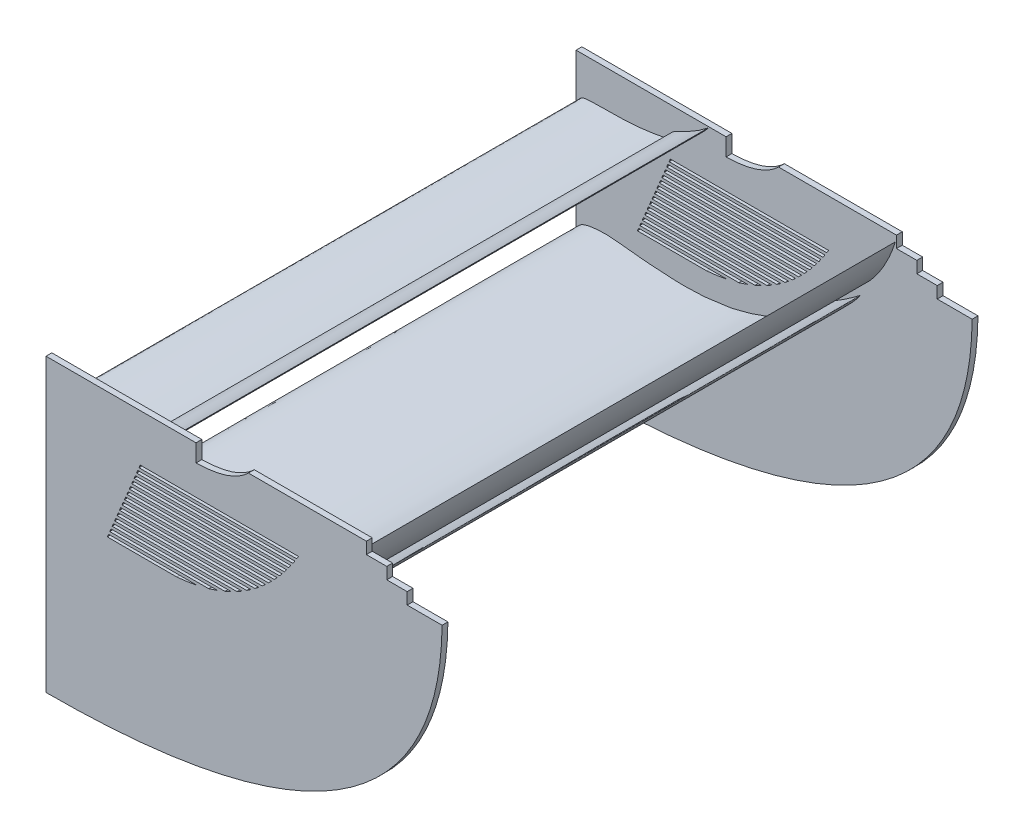
from build123d import *

# Parameters (mm, degrees)
BOSS_EXTRUDE1_DEPTH   = 900
BOSS_EXTRUDE1_2_DEPTH = 900
BOSS_EXTRUDE1_3_DEPTH = 900
BOSS_EXTRUDE2_DEPTH   = 10
BOSS_EXTRUDE3_DEPTH   = 900
CUT_EXTRUDE1_DEPTH    = 900
CUT_EXTRUDE2_DEPTH    = 900


with BuildPart() as part:
    # Sketch2 → Boss-Extrude1 (new body)
    with BuildSketch(Plane.XY):
        with BuildLine():
            add(Edge.make_bspline(
                [(0, 0), (-0.65975565, -5.699703464), (8.017548516, -15.480562025), (19.551157506, -21.724015646), (30.016745353, -25.302215165), (39.859962541, -28.8642232), (50.040399275, -30.662933418), (60.070603806, -32.257702331), (70.013877162, -34.217674322), (80.100972933, -34.55999195), (90.093066457, -35.36519438), (100.111969814, -35.952943269), (110.128217778, -35.507216678), (120.153157744, -35.210003546), (130.150331683, -34.229800116), (140.189993261, -33.410162922), (150.178235204, -31.913406007), (160.170449627, -30.371338734), (170.240789754, -29.163640841), (180.208316099, -27.151030087), (190.263801281, -25.306120223), (200.239152099, -22.872450662), (210.244577583, -20.429111012), (220.232934245, -17.895088966), (230.381125348, -15.705438437), (240.351948949, -12.391144832), (253.551193017, -7.369638816), (266.947574476, -2.806549313), (280.436865809, 1.636643436), (290.361357742, 5.819516769), (300.440735094, 10.032227759), (310.304777653, 14.884053202), (323.821431636, 20.884190166), (337.30228202, 27.249833417), (350.274680503, 34.850235797), (364.037447664, 41.200679435), (378.073354269, 50.431878374), (389.268655411, 56.991671546), (404.933124868, 70.670428585), (388.893146181, 60.897261379), (380.961681237, 56.833339948), (370.316551331, 52.173205743), (360.413556578, 47.749137904), (350.469658047, 43.075442492), (340.496714174, 38.833200032), (330.405194537, 35.260956145), (320.349773519, 31.849438488), (310.358327921, 28.32591748), (300.486931551, 24.662169398), (290.321799777, 22.300639283), (280.290360105, 19.76188557), (270.426731207, 16.765017679), (260.335958512, 15.061341224), (250.276874186, 13.958758108), (240.266180313, 12.578254982), (230.278688892, 11.06786106), (220.28670052, 9.696364143), (210.243264635, 9.240413966), (200.228739037, 9.034505305), (190.217040672, 8.279165066), (180.212460889, 9.162360851), (170.184221628, 8.728504773), (160.186505008, 9.582197967), (150.167787888, 9.989196896), (140.163470123, 10.700746944), (130.145958281, 11.214450998), (120.121382338, 11.840881885), (110.132801048, 12.969737489), (100.114836916, 13.850136605), (90.093770057, 14.715857774), (80.079633724, 15.842660607), (56.917746978, 18.847498868), (32.382831952, 18.963380484), (8.41761673, 12.262874152), (0.546057517, 4.717452477), (0, 0)],
                knots=[0, 0, 0, 0, 0.022023736, 0.035622153, 0.048196888, 0.060584536, 0.072602109, 0.084545422, 0.096478612, 0.108283816, 0.120089627, 0.131879307, 0.143660654, 0.15544949, 0.167268546, 0.17910001, 0.190991158, 0.20289685, 0.214787999, 0.226765538, 0.23876847, 0.250863752, 0.262991876, 0.27512, 0.287234564, 0.299600692, 0.31214973, 0.337081787, 0.34954249, 0.362249466, 0.375072168, 0.388091419, 0.401030286, 0.427260863, 0.440708926, 0.453891579, 0.481343844, 0.495528159, 0.510184265, 0.522427916, 0.535732546, 0.548643086, 0.561553626, 0.574510663, 0.587286643, 0.599816472, 0.612271303, 0.624763182, 0.637218013, 0.649381244, 0.661544475, 0.673750263, 0.685718325, 0.697586388, 0.709471547, 0.721375261, 0.733243324, 0.745039761, 0.756824219, 0.768610895, 0.780397571, 0.792175284, 0.803971722, 0.815766061, 0.82756692, 0.839363385, 0.851169099, 0.863005976, 0.874833225, 0.886659586, 0.898509641, 0.910371212, 0.969295412, 0.981771696, 1, 1, 1, 1], degree=3))
        make_face()
    extrude(amount=BOSS_EXTRUDE1_DEPTH)



with BuildPart() as body_2:
    # Sketch2 → Boss-Extrude1 2 (new body)
    with BuildSketch(Plane.XY):
        with BuildLine():
            add(Edge.make_bspline(
                [(488.73992863, 146.276625829), (488.734390863, 146.282664356), (488.424255517, 146.015046997), (488.06224571, 145.78510435), (487.262468982, 145.126312202), (486.219708703, 144.371292999), (484.873478649, 143.336701677), (483.250678892, 142.116067573), (481.344943871, 140.702556836), (479.183854282, 139.108333078), (476.761259361, 137.364331889), (474.123745832, 135.449437464), (471.236790602, 133.439330858), (468.165688429, 131.291310186), (464.896239769, 129.067635846), (461.457519682, 126.769533617), (457.874048726, 124.410588123), (454.151349507, 122.026984888), (450.329646269, 119.608278587), (446.41836705, 117.19210493), (442.442349173, 114.792641259), (438.43193703, 112.415341988), (434.42114363, 110.058907294), (430.419325782, 107.74839744), (426.469079038, 105.475179612), (422.572434597, 103.270040027), (418.782946314, 101.105445668), (415.103822048, 99.01892845), (411.581105321, 96.980001912), (408.223119368, 95.024650916), (405.070149132, 93.117181313), (402.117764879, 91.312769814), (399.415735867, 89.554324386), (396.965291652, 87.893504979), (394.792388291, 86.318571947), (392.915837215, 84.829964237), (391.349809227, 83.430905822), (390.083467317, 82.150893966), (389.152598068, 80.964624913), (388.566460536, 79.872034746), (388.31048608, 78.86894122), (388.452520239, 77.947544055), (389.013376817, 77.204475769), (389.915554573, 76.684991476), (391.128157446, 76.384212118), (392.650081725, 76.254634507), (394.48507873, 76.313765499), (396.623198675, 76.579439281), (399.045948072, 77.035742523), (401.735792151, 77.720460618), (404.675674285, 78.596752435), (407.839178956, 79.704940552), (411.200777121, 81.026852514), (414.720896472, 82.590974299), (418.395557374, 84.341793332), (422.179917585, 86.309143039), (426.045683707, 88.480043342), (429.970357242, 90.828820323), (433.914957703, 93.364526939), (437.871228384, 96.040204149), (441.793376071, 98.866131635), (445.668479549, 101.797178284), (449.465692449, 104.827226536), (453.167907327, 107.924049831), (456.76145535, 111.053999458), (460.202936902, 114.219487851), (463.519091154, 117.342970547), (466.650128692, 120.455005022), (469.613566921, 123.489837804), (472.370170636, 126.450937081), (474.953957291, 129.265647603), (477.297780382, 131.960513478), (479.456204478, 134.463515761), (481.381106749, 136.784579704), (483.077897662, 138.897364919), (484.557730654, 140.769579134), (485.809879979, 142.38248786), (486.847928071, 143.738913606), (487.625844434, 144.768628828), (488.251100258, 145.595659419), (488.480713959, 145.957078055), (488.74539046, 146.270670107), (488.73992863, 146.276625829)],
                knots=[0, 0, 0, 0, 0.000781199, 0.003073574, 0.006930933, 0.012248071, 0.019030102, 0.027225991, 0.036784991, 0.047610037, 0.059602429, 0.072763906, 0.086896902, 0.102003859, 0.117938515, 0.134556032, 0.151857595, 0.169650659, 0.187837924, 0.206373783, 0.225065344, 0.243814112, 0.262569213, 0.281136751, 0.299513586, 0.317505655, 0.335105223, 0.352118009, 0.368487898, 0.384166869, 0.39895523, 0.412906354, 0.425871787, 0.437810597, 0.448585292, 0.458212857, 0.466668993, 0.473884465, 0.479894259, 0.484778924, 0.488742849, 0.492166792, 0.495627983, 0.499576303, 0.504486665, 0.51057614, 0.517942731, 0.526573967, 0.536524046, 0.547640111, 0.560015283, 0.573490911, 0.58803144, 0.603543533, 0.619911609, 0.637089411, 0.654944026, 0.673346428, 0.692212491, 0.711460838, 0.730910148, 0.750475101, 0.77002178, 0.789460649, 0.808651173, 0.827457923, 0.845819698, 0.863558965, 0.880665567, 0.896944906, 0.912322084, 0.926717772, 0.939992516, 0.952161421, 0.963060032, 0.972661788, 0.980906352, 0.987732879, 0.993080076, 0.996902186, 0.999229514, 1, 1, 1, 1], degree=3))
        make_face()
    extrude(amount=BOSS_EXTRUDE1_2_DEPTH)


with BuildPart() as body_3:
    # Sketch2 → Boss-Extrude1 3 (new body)
    with BuildSketch(Plane.XY):
        with BuildLine():
            add(Edge.make_bspline(
                [(548.142677429, 255.362022493), (548.135374227, 255.365952606), (547.927936153, 255.006923964), (547.658371583, 254.666651265), (547.113002911, 253.770748213), (546.367364831, 252.702005657), (545.424638558, 251.265023805), (544.27941979, 249.558165284), (542.927897021, 247.572779047), (541.392389605, 245.329670238), (539.656724271, 242.856366084), (537.77246287, 240.148181213), (535.681420522, 237.265978202), (533.460225952, 234.1906606), (531.074588655, 230.97702341), (528.551895931, 227.635912658), (525.911068883, 224.188473742), (523.145346923, 220.671136821), (520.29665909, 217.087300279), (517.361495783, 213.476080086), (514.358883712, 209.859293663), (511.316016626, 206.252251869), (508.265842752, 202.665029322), (505.208968651, 199.124696426), (502.1889872, 195.637173296), (499.197596623, 192.232566763), (496.295154414, 188.902374923), (493.472239146, 185.683544867), (490.783011296, 182.562252326), (488.223454385, 179.575667492), (485.843956575, 176.703071592), (483.621924068, 173.995738505), (481.623931594, 171.41564926), (479.833965661, 169.012598811), (478.280745879, 166.784000715), (476.982109533, 164.736533764), (475.9505309, 162.877995089), (475.165835333, 161.232977644), (474.670653437, 159.789198906), (474.473857946, 158.549678558), (474.562913108, 157.505571006), (475.005273255, 156.671993733), (475.788683212, 156.148250847), (476.823995566, 155.951818146), (478.083297743, 156.067751239), (479.581340455, 156.450270824), (481.315884792, 157.117361276), (483.27148496, 158.082761094), (485.435756441, 159.325104089), (487.779363945, 160.874677932), (490.298259918, 162.690587977), (492.953775055, 164.80259248), (495.727550679, 167.184824621), (498.572278285, 169.851349424), (501.502624239, 172.747773867), (504.46579375, 175.887697633), (507.439057803, 179.249297912), (510.409450838, 182.800544998), (513.336696107, 186.537123271), (516.228525151, 190.411393589), (519.037740226, 194.417946242), (521.767005491, 198.509337516), (524.388867963, 202.669455575), (526.897696092, 206.861800297), (529.291618766, 211.049656155), (531.528344155, 215.220888935), (533.659235885, 219.310264722), (535.616969063, 223.327101968), (537.440168258, 227.214370322), (539.090171449, 230.962330487), (540.623673351, 234.512844247), (541.967651222, 237.868945421), (543.198230675, 240.979940777), (544.266104832, 243.839306635), (545.18521028, 246.423662369), (545.97695415, 248.705848341), (546.637316417, 250.664385968), (547.178342468, 252.306492823), (547.579395063, 253.549717004), (547.901947032, 254.548383811), (548.001197383, 254.970292394), (548.149880485, 255.358146272), (548.142677429, 255.362022493)],
                knots=[0, 0, 0, 0, 0.000781199, 0.003073574, 0.006930933, 0.012248071, 0.019030102, 0.027225991, 0.036784991, 0.047610037, 0.059602429, 0.072763906, 0.086896902, 0.102003859, 0.117938515, 0.134556032, 0.151857595, 0.169650659, 0.187837924, 0.206373783, 0.225065344, 0.243814112, 0.262569213, 0.281136751, 0.299513586, 0.317505655, 0.335105223, 0.352118009, 0.368487898, 0.384166869, 0.39895523, 0.412906354, 0.425871787, 0.437810597, 0.448585292, 0.458212857, 0.466668993, 0.473884465, 0.479894259, 0.484778924, 0.488742849, 0.492166792, 0.495627983, 0.499576303, 0.504486665, 0.51057614, 0.517942731, 0.526573967, 0.536524046, 0.547640111, 0.560015283, 0.573490911, 0.58803144, 0.603543533, 0.619911609, 0.637089411, 0.654944026, 0.673346428, 0.692212491, 0.711460838, 0.730910148, 0.750475101, 0.77002178, 0.789460649, 0.808651173, 0.827457923, 0.845819698, 0.863558965, 0.880665567, 0.896944906, 0.912322084, 0.926717772, 0.939992516, 0.952161421, 0.963060032, 0.972661788, 0.980906352, 0.987732879, 0.993080076, 0.996902186, 0.999229514, 1, 1, 1, 1], degree=3))
        make_face()
    extrude(amount=BOSS_EXTRUDE1_3_DEPTH)


with BuildPart() as part_1:
    add(part.part)

    add(body_2.part)  # Boss-Extrude2 merges body 2

    add(body_3.part)  # Boss-Extrude2 merges body 3
    # Sketch5 → Boss-Extrude2 (add)
    with BuildSketch(Plane.XY):
        with BuildLine():
            Line((0, 266.2835253), (550.000000941, 266.2835253))
            Line((550.000000941, 266.2835253), (550.000000941, 246.2835253))
            Line((550.000000941, 246.2835253), (585.000000941, 246.2835253))
            Line((585.000000941, 246.2835253), (585.000000941, 226.2835253))
            Line((585.000000941, 226.2835253), (620.000000941, 226.2835253))
            Line((620.000000941, 226.2835253), (620.000000941, 206.2835253))
            Line((620.000000941, 206.2835253), (680.000000941, 206.2835253))
            add(Edge.make_bspline(
                [(680.000000941, 206.2835253), (675.000000941, -233.7164747), (0, -233.7164747)],
                knots=[0, 0, 0, 1, 1, 1], degree=2))
            Line((0, -233.7164747), (0, 0))
            Line((0, 0), (0, 266.2835253))
        make_face()
    boss_extrude2 = extrude(amount=-BOSS_EXTRUDE2_DEPTH)

    # Sketch6 → Boss-Extrude3 (add)
    with BuildSketch(Plane.XY):
        with BuildLine():
            Line((164.613779142, 214.976136412), (164.723820378, 214.664469851))
            add(Edge.make_bspline(
                [(164.723820378, 214.664469851), (164.648520792, 214.62785328), (164.34784185, 214.481639572), (163.6724355, 214.155247545), (162.549996952, 213.617503095), (160.985188719, 212.878254816), (158.984976969, 211.950245078), (156.558091459, 210.85008651), (153.715646415, 209.596574891), (150.470623362, 208.21147628), (146.838789716, 206.717746076), (142.837921693, 205.140231242), (138.488175426, 203.504962048), (133.812181859, 201.837638924), (128.834692226, 200.164989269), (123.582914289, 198.512714614), (118.086213642, 196.905948015), (112.376209789, 195.368272822), (106.486191905, 193.922834665), (100.451747873, 192.589384758), (94.309682922, 191.38731623), (88.098789404, 190.332048871), (81.858862431, 189.437445075), (75.630944666, 188.713169975), (69.456595048, 188.167141909), (63.377832973, 187.802732102), (57.436667454, 187.619920942), (51.674457693, 187.615799885), (46.131746943, 187.783455241), (40.847534236, 188.112237796), (35.858963346, 188.588868306), (31.20097477, 189.198026011), (26.905404603, 189.920290668), (23.001348407, 190.736844339), (19.514136341, 191.626300897), (16.465607968, 192.567963312), (13.873059459, 193.541178882), (11.74976335, 194.527328758), (10.100256038, 195.510564925), (8.925718365, 196.483778626), (8.206176783, 197.466132507), (8.02697547, 198.508882414), (8.470227148, 199.467441428), (9.409476098, 200.23160778), (10.773566742, 200.880043737), (12.581737712, 201.435839127), (14.827891197, 201.90662304), (17.501946446, 202.294971106), (20.58639208, 202.606885827), (24.061416159, 202.847331482), (27.90441349, 203.025263473), (32.091168331, 203.149306121), (36.595944484, 203.230963582), (41.391766004, 203.282006476), (46.450521964, 203.315413628), (51.743070657, 203.344475349), (57.239340133, 203.383502231), (62.908274903, 203.445583094), (68.717937055, 203.543500979), (74.635487392, 203.689136944), (80.627254443, 203.892101324), (86.658821204, 204.160206649), (92.695207803, 204.498909479), (98.701000079, 204.910411263), (104.640477999, 205.395096222), (110.477863333, 205.94945889), (116.177758049, 206.567602145), (121.705063984, 207.24121294), (127.025524467, 207.95920193), (132.10555678, 208.709379121), (136.913134386, 209.476904936), (141.417305129, 210.247217657), (145.589030953, 211.004246644), (149.400935644, 211.732409722), (152.827876226, 212.416494827), (155.846829262, 213.041879937), (158.437432591, 213.595225115), (160.581893041, 214.064998422), (162.265605107, 214.441007828), (163.476700085, 214.71550428), (164.206793843, 214.882591132), (164.532232533, 214.957392982), (164.613779142, 214.976136412)],
                knots=[0, 0, 0, 0, 0.000779512, 0.003112672, 0.006983595, 0.012366453, 0.01922443, 0.027511488, 0.037172952, 0.048145315, 0.060357993, 0.073731396, 0.088181725, 0.103618331, 0.119946063, 0.137064586, 0.154870456, 0.17325674, 0.192112831, 0.211327336, 0.230785914, 0.250372996, 0.269971687, 0.289465461, 0.308737124, 0.32767029, 0.346151173, 0.364066139, 0.381306847, 0.39776766, 0.413347451, 0.427951846, 0.441492525, 0.453889871, 0.465073667, 0.474985038, 0.483580064, 0.490834634, 0.496756017, 0.501407245, 0.504968517, 0.50787306, 0.510776977, 0.514326794, 0.518938798, 0.524777979, 0.531895445, 0.540287366, 0.549922226, 0.560751286, 0.572712462, 0.585735823, 0.599744882, 0.61465722, 0.63038614, 0.646841751, 0.663930407, 0.681556403, 0.699621216, 0.718024312, 0.736663476, 0.755434295, 0.774231121, 0.792947914, 0.811476445, 0.829708517, 0.847535554, 0.86485073, 0.881545736, 0.89751548, 0.912656405, 0.926869016, 0.94005631, 0.952127904, 0.962998201, 0.972589475, 0.980830171, 0.987660039, 0.993027268, 0.996891237, 0.999221024, 1, 1, 1, 1], degree=3))
        make_face()
        with BuildLine():
            Line((227.014165374, 264.226922408), (227.124498683, 264.117683735))
            add(Edge.make_bspline(
                [(227.124498683, 264.117683735), (227.100159849, 264.086786218), (227.002972401, 263.963409277), (226.784244674, 263.687135237), (226.419789721, 263.229980722), (225.90956242, 262.59706416), (225.25389914, 261.795199069), (224.453089487, 260.833196326), (223.507984217, 259.721278001), (222.419615428, 258.471304258), (221.18994955, 257.09620847), (219.821415035, 255.610135011), (218.317204263, 254.028215794), (216.681623457, 252.365949967), (214.919665011, 250.639704962), (213.037569937, 248.865917434), (211.042607934, 247.061225478), (208.943318901, 245.242073454), (206.749038269, 243.425062503), (204.470768289, 241.625829285), (202.120099201, 239.8601083), (199.710274859, 238.142361018), (197.255281925, 236.486595763), (194.770493839, 234.905301737), (192.271859948, 233.410335323), (189.776455231, 232.011724723), (187.302044509, 230.718062416), (184.866709335, 229.536586443), (182.489006296, 228.472674472), (180.187603898, 227.52980869), (177.980924736, 226.709979502), (175.886877861, 226.013863102), (173.922899143, 225.439766898), (172.105142481, 224.985691856), (170.448695615, 224.647782235), (168.967029431, 224.421758982), (167.671684859, 224.302431588), (166.572085289, 224.284645643), (165.673393307, 224.362629601), (164.977563579, 224.533619745), (164.472228287, 224.801628451), (164.182975782, 225.205799004), (164.174124327, 225.701813604), (164.414772581, 226.217190457), (164.858731971, 226.770618702), (165.509408986, 227.375799229), (166.362663608, 228.034709064), (167.413706516, 228.746373252), (168.653905221, 229.509744345), (170.073867156, 230.322864947), (171.662201674, 231.184893168), (173.406905, 232.094517404), (175.294740921, 233.051332311), (177.311894526, 234.054791381), (179.443823684, 235.104626545), (181.675486694, 236.200490389), (183.991239673, 237.342276403), (186.375273051, 238.529160164), (188.811466791, 239.760007307), (191.28350447, 241.033117593), (193.775182692, 242.345660362), (196.270350938, 243.693892226), (198.753103068, 245.072958488), (201.208015771, 246.476539327), (203.619908469, 247.897483995), (205.974372342, 249.326985329), (208.257648968, 250.755302848), (210.456601334, 252.171736048), (212.559016607, 253.564582929), (214.553192236, 254.921814136), (216.428626064, 256.230598714), (218.17521328, 257.47844315), (219.783967257, 258.652607865), (221.246503967, 259.740900035), (222.555307784, 260.731740538), (223.703638392, 261.614233662), (224.685618133, 262.378570601), (225.496085319, 263.016232908), (226.130951632, 263.519921264), (226.586785668, 263.883929527), (226.861249996, 264.104048143), (226.983526109, 264.202302404), (227.014165374, 264.226922408)],
                knots=[0, 0, 0, 0, 0.000779512, 0.003112672, 0.006983595, 0.012366453, 0.01922443, 0.027511488, 0.037172952, 0.048145315, 0.060357993, 0.073731396, 0.088181725, 0.103618331, 0.119946063, 0.137064586, 0.154870456, 0.17325674, 0.192112831, 0.211327336, 0.230785914, 0.250372996, 0.269971687, 0.289465461, 0.308737124, 0.32767029, 0.346151173, 0.364066139, 0.381306847, 0.39776766, 0.413347451, 0.427951846, 0.441492525, 0.453889871, 0.465073667, 0.474985038, 0.483580064, 0.490834634, 0.496756017, 0.501407245, 0.504968517, 0.50787306, 0.510776977, 0.514326794, 0.518938798, 0.524777979, 0.531895445, 0.540287366, 0.549922226, 0.560751286, 0.572712462, 0.585735823, 0.599744882, 0.61465722, 0.63038614, 0.646841751, 0.663930407, 0.681556403, 0.699621216, 0.718024312, 0.736663476, 0.755434295, 0.774231121, 0.792947914, 0.811476445, 0.829708517, 0.847535554, 0.86485073, 0.881545736, 0.89751548, 0.912656405, 0.926869016, 0.94005631, 0.952127904, 0.962998201, 0.972589475, 0.980830171, 0.987660039, 0.993027268, 0.996891237, 0.999221024, 1, 1, 1, 1], degree=3))
        make_face()
    extrude(amount=BOSS_EXTRUDE3_DEPTH)

    # Sketch7 → Cut-Extrude1 (cut)
    with BuildSketch(Plane.XY):
        with BuildLine():
            Line((257.530092853, 266.2835253), (257.530092853, 236.2835253))
            add(Edge.make_bspline(
                [(347.530092853, 266.2835253), (317.571378056, 237.21102108), (257.530092853, 236.2835253)],
                knots=[0, 0, 0, 1, 1, 1], degree=2))
            Line((347.530092853, 266.2835253), (257.530092853, 266.2835253))
        make_face()
    cut_extrude1 = extrude(amount=-CUT_EXTRUDE1_DEPTH, mode=Mode.SUBTRACT)

    # Sketch8 → Cut-Extrude2 (cut)
    with BuildSketch(Plane.XY):
        with BuildLine():
            Line((161.803662931, 185.278358624), (433.527522538, 185.278358624))
            add(Edge.make_bspline(
                [(433.527522538, 185.278358624), (431.986033483, 182.754958382), (430.420792306, 180.278358625)],
                knots=[0, 0, 0, 0.017044084, 0.017044084, 0.017044084], degree=2))
            Line((430.420792306, 180.278358625), (159.708601591, 180.278358625))
            Line((159.708601591, 180.278358625), (161.803662931, 185.278358624))
        make_face()
        with BuildLine():
            Line((155.51847891, 170.278358624), (423.874587116, 170.278358624))
            add(Edge.make_bspline(
                [(427.205326309, 175.278358623), (426.103638199, 173.59482896), (424.993391797, 171.928162297), (423.874587116, 170.278358624)],
                knots=[0.034416516, 0.034416516, 0.034416516, 0.034416516, 0.052137037, 0.052137037, 0.052137037, 0.052137037], degree=3))
            Line((427.205326309, 175.278358623), (157.61354025, 175.278358623))
            Line((157.61354025, 175.278358623), (155.51847891, 170.278358624))
        make_face()
        with BuildLine():
            Line((151.328356229, 160.278358623), (416.837622605, 160.278358623))
            add(Edge.make_bspline(
                [(420.421354783, 165.278358623), (419.236089505, 163.593343639), (418.041512112, 161.926676973), (416.837622605, 160.278358623)],
                knots=[0.070227449, 0.070227449, 0.070227449, 0.070227449, 0.088711929, 0.088711929, 0.088711929, 0.088711929], degree=3))
            Line((420.421354783, 165.278358623), (153.42341757, 165.278358623))
            Line((153.42341757, 165.278358623), (151.328356229, 160.278358623))
        make_face()
        with BuildLine():
            Line((147.138233549, 150.278358623), (409.241918291, 150.278358623))
            add(Edge.make_bspline(
                [(413.114471658, 155.278358622), (411.833832124, 153.591571342), (410.542981002, 151.924904676), (409.241918291, 150.278358623)],
                knots=[0.107617411, 0.107617411, 0.107617411, 0.107617411, 0.12697404, 0.12697404, 0.12697404, 0.12697404], degree=3))
            Line((413.114471658, 155.278358622), (149.233294889, 155.278358622))
            Line((149.233294889, 155.278358622), (147.138233549, 150.278358623))
        make_face()
        with BuildLine():
            Line((142.948110868, 140.278358622), (401.00217999, 140.278358622))
            add(Edge.make_bspline(
                [(405.208727185, 145.278358621), (403.817848225, 143.589419991), (402.415665827, 141.922753326), (401.00217999, 140.278358622)],
                knots=[0.146815745, 0.146815745, 0.146815745, 0.146815745, 0.167180931, 0.167180931, 0.167180931, 0.167180931], degree=3))
            Line((405.208727185, 145.278358621), (145.043172208, 145.278358621))
            Line((145.043172208, 145.278358621), (142.948110868, 140.278358622))
        make_face()
        with BuildLine():
            Line((138.757988187, 130.278358621), (392.008915127, 130.278358621))
            add(Edge.make_bspline(
                [(396.607785875, 135.278358621), (395.087485747, 133.586753391), (393.554528832, 131.920086723), (392.008915127, 130.278358621)],
                knots=[0.188113355, 0.188113355, 0.188113355, 0.188113355, 0.209663235, 0.209663235, 0.209663235, 0.209663235], degree=3))
            Line((396.607785875, 135.278358621), (140.853049527, 135.278358621))
            Line((140.853049527, 135.278358621), (138.757988187, 130.278358621))
        make_face()
        with BuildLine():
            Line((134.567865506, 120.278358621), (382.117568981, 120.278358621))
            add(Edge.make_bspline(
                [(387.186329186, 125.27835862), (385.511120845, 123.583361188), (383.821534109, 121.916694525), (382.117568981, 120.278358621)],
                knots=[0.231888664, 0.231888664, 0.231888664, 0.231888664, 0.254857463, 0.254857463, 0.254857463, 0.254857463], degree=3))
            Line((387.186329186, 125.27835862), (136.662926846, 125.27835862))
            Line((136.662926846, 125.27835862), (134.567865506, 120.278358621))
        make_face()
        with BuildLine():
            Line((130.377742825, 110.27835862), (371.130448262, 110.27835862))
            add(Edge.make_bspline(
                [(376.776145493, 115.278358619), (374.910888715, 113.578900458), (373.028989635, 111.912233792), (371.130448262, 110.27835862)],
                knots=[0.278649618, 0.278649618, 0.278649618, 0.278649618, 0.303360585, 0.303360585, 0.303360585, 0.303360585], degree=3))
            Line((376.776145493, 115.278358619), (132.472804165, 115.278358619))
            Line((132.472804165, 115.278358619), (130.377742825, 110.27835862))
        make_face()
        with BuildLine():
            Line((126.187620144, 100.278358619), (358.764540814, 100.278358619))
            add(Edge.make_bspline(
                [(365.142241667, 105.278358619), (363.036094183, 103.572771614), (360.9101939, 101.906104944), (358.764540814, 100.278358619)],
                knots=[0.329105822, 0.329105822, 0.329105822, 0.329105822, 0.35602721, 0.35602721, 0.35602721, 0.35602721], degree=3))
            Line((365.142241667, 105.278358619), (128.282681484, 105.278358619))
            Line((128.282681484, 105.278358619), (126.187620144, 100.278358619))
        make_face()
        with BuildLine():
            Line((121.997497463, 90.278358619), (344.58887312, 90.278358619))
            add(Edge.make_bspline(
                [(351.938522321, 95.278358618), (349.512933739, 93.563822812), (347.063050674, 91.897156142), (344.58887312, 90.278358619)],
                knots=[0.384302376, 0.384302376, 0.384302376, 0.384302376, 0.414158742, 0.414158742, 0.414158742, 0.414158742], degree=3))
            Line((351.938522321, 95.278358618), (124.092558803, 95.278358618))
            Line((124.092558803, 95.278358618), (121.997497463, 90.278358619))
        make_face()
        with BuildLine():
            Line((117.807374782, 80.278358618), (327.886387735, 80.278358618))
            add(Edge.make_bspline(
                [(336.616487009, 85.278358617), (333.738005948, 83.549522756), (330.827972857, 81.882856089), (327.886387735, 80.278358618)],
                knots=[0.445895578, 0.445895578, 0.445895578, 0.445895578, 0.47992047, 0.47992047, 0.47992047, 0.47992047], degree=3))
            Line((336.616487009, 85.278358617), (119.902436122, 85.278358617))
            Line((119.902436122, 85.278358617), (117.807374782, 80.278358618))
        make_face()
        with BuildLine():
            Line((113.617252101, 70.278358617), (307.286080617, 70.278358617))
            add(Edge.make_bspline(
                [(318.206400634, 75.278358617), (314.611304353, 73.523004798), (310.97119768, 71.856338132), (307.286080617, 70.278358617)],
                knots=[0.516813724, 0.516813724, 0.516813724, 0.516813724, 0.557452394, 0.557452394, 0.557452394, 0.557452394], degree=3))
            Line((318.206400634, 75.278358617), (115.712313441, 75.278358617))
            Line((115.712313441, 75.278358617), (113.617252101, 70.278358617))
        make_face()
        with BuildLine():
            Line((109.42712942, 60.278358617), (279.393756019, 60.278358617))
            add(Edge.make_bspline(
                [(294.647543822, 65.278358616), (289.641612, 63.456694494), (284.557016067, 61.790027823), (279.393756019, 60.278358617)],
                knots=[0.603279538, 0.603279538, 0.603279538, 0.603279538, 0.657003919, 0.657003919, 0.657003919, 0.657003919], degree=3))
            Line((294.647543822, 65.278358616), (111.52219076, 65.278358616))
            Line((111.52219076, 65.278358616), (109.42712942, 60.278358617))
        make_face()
        with BuildLine():
            Line((105.237006739, 50.278358616), (224.538691684, 50.278358616))
            add(Edge.make_bspline(
                [(259.386529007, 55.278358615), (248.117929064, 52.927291927), (236.50198329, 51.260625257), (224.538691684, 50.278358616)],
                knots=[0.725082192, 0.725082192, 0.725082192, 0.725082192, 0.837974445, 0.837974445, 0.837974445, 0.837974445], degree=3))
            Line((259.386529007, 55.278358615), (107.332068079, 55.278358615))
            Line((107.332068079, 55.278358615), (105.237006739, 50.278358616))
        make_face()
    cut_extrude2 = extrude(amount=-CUT_EXTRUDE2_DEPTH, mode=Mode.SUBTRACT)

    # Mirror1: Boss-Extrude2, Cut-Extrude1, Cut-Extrude2 across plane
    add(boss_extrude2.mirror(Plane.XY.offset(450)))
    add(cut_extrude1.mirror(Plane.XY.offset(450)), mode=Mode.SUBTRACT)
    add(cut_extrude2.mirror(Plane.XY.offset(450)), mode=Mode.SUBTRACT)


solid = part_1.part
